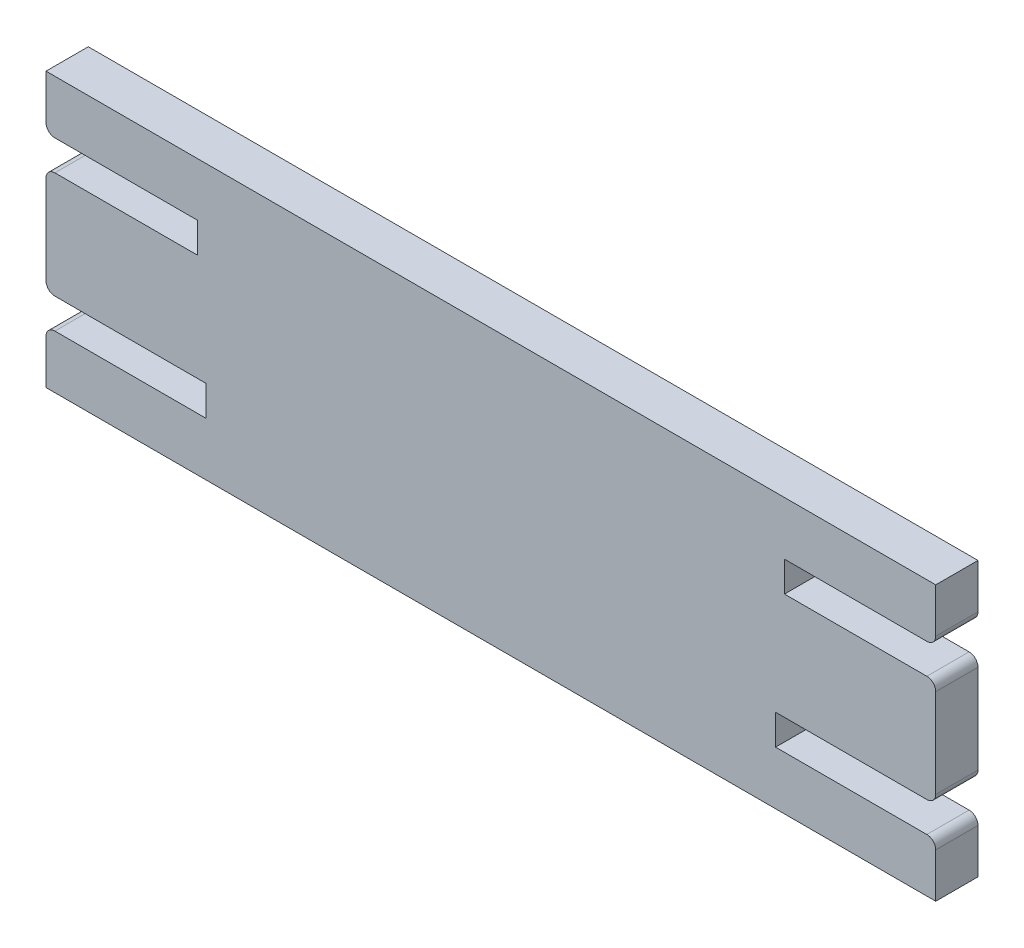
from build123d import *

# Parameters (mm, degrees)
BOSS_EXTRUDE1_DEPTH = 4.75


with BuildPart() as part:
    # Sketch1 → Boss-Extrude1 (new body)
    with BuildSketch(Plane.XY):
        with BuildLine():
            Line((28.105438967, -10.25), (28.105438967, -15.25))
            Line((28.105438967, -15.25), (-71.894561033, -15.25))
            Line((-71.894561033, -15.25), (-71.894561033, -10.25))
            ThreePointArc((-71.894561033, -10.25), (-71.601667814, -9.542893219), (-70.894561033, -9.25))
            Line((-70.894561033, -9.25), (-53.894561033, -9.25))
            Line((-53.894561033, -9.25), (-53.894561033, -5.85))
            Line((-53.894561033, -5.85), (-70.894561033, -5.85))
            ThreePointArc((-70.894561033, -5.85), (-71.601667814, -5.557106781), (-71.894561033, -4.85))
            Line((-71.894561033, -4.85), (-71.894561033, 5.15))
            ThreePointArc((-71.894561033, 5.15), (-71.601667814, 5.857106781), (-70.894561033, 6.15))
            Line((-70.894561033, 6.15), (-54.894561033, 6.15))
            Line((-54.894561033, 6.15), (-54.894561033, 9.55))
            Line((-54.894561033, 9.55), (-70.894561033, 9.55))
            ThreePointArc((-70.894561033, 9.55), (-71.601667814, 9.842893219), (-71.894561033, 10.55))
            Line((-71.894561033, 10.55), (-71.894561033, 15.55))
            Line((-71.894561033, 15.55), (28.105438967, 15.55))
            Line((28.105438967, 15.55), (28.105438967, 10.55))
            ThreePointArc((28.105438967, 10.55), (27.812545748, 9.842893219), (27.105438967, 9.55))
            Line((27.105438967, 9.55), (11.105438967, 9.55))
            Line((11.105438967, 9.55), (11.105438967, 6.15))
            Line((11.105438967, 6.15), (27.105438967, 6.15))
            ThreePointArc((27.105438967, 6.15), (27.812545748, 5.857106781), (28.105438967, 5.15))
            Line((28.105438967, 5.15), (28.105438967, -4.85))
            ThreePointArc((28.105438967, -4.85), (27.812545748, -5.557106781), (27.105438967, -5.85))
            Line((27.105438967, -5.85), (10.105438967, -5.85))
            Line((10.105438967, -5.85), (10.105438967, -9.25))
            Line((10.105438967, -9.25), (27.105438967, -9.25))
            ThreePointArc((27.105438967, -9.25), (27.812545748, -9.542893219), (28.105438967, -10.25))
        make_face()
    extrude(amount=BOSS_EXTRUDE1_DEPTH)


solid = part.part
